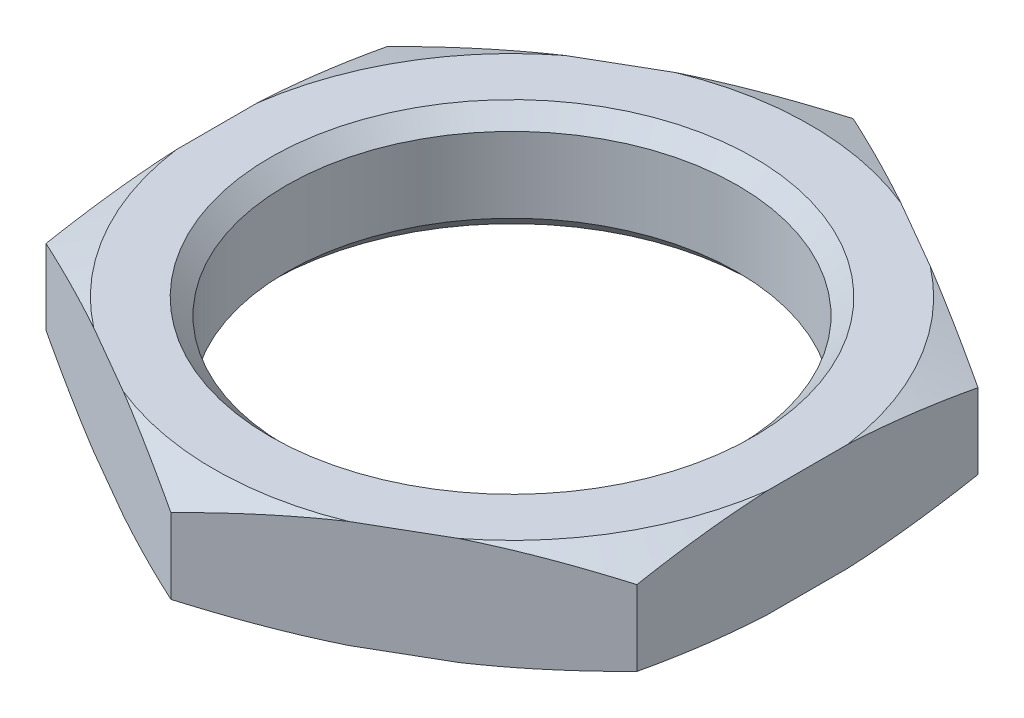
from build123d import *

# Parameters (mm, degrees)
SKETCH1_R           = 4.2
BOSS_EXTRUDE1_DEPTH = 2
CHAMFER1_SIZE       = 0.3


with BuildPart() as part:
    # Sketch1 → Boss-Extrude1 (new body)
    with BuildSketch(Plane(origin=(0, 0, 0), x_dir=(1, 0, 0), z_dir=(0, 1, 0))):
        Polygon((0, 6.350852961), (-5.5, 3.175426481), (-5.5, -3.175426481), (0, -6.350852961), (5.5, -3.175426481), (5.5, 3.175426481), align=None)
        with Locations(Location((0, 0, 0), (0, 0, 270))):
            Circle(SKETCH1_R, mode=Mode.SUBTRACT)
    extrude(amount=BOSS_EXTRUDE1_DEPTH)

    # Chamfer1
    chamfer1_edges = [part.edges().sort_by_distance(p)[0] for p in [
        (0, 0, -4.2),
        (0, 2, -4.2),
    ]]
    chamfer(chamfer1_edges, length=CHAMFER1_SIZE)

    # Sketch3 → Cut-Revolve1 (revolve, cut)
    with BuildSketch(Plane(origin=(0, 0, 0), x_dir=(0, 0, -1), z_dir=(1, 0, 0))):
        Polygon((-6.350852961, 0), (-5.550852961, 0), (-6.350852961, 0.3), align=None)
        Polygon((-6.350852961, 2), (-6.350852961, 1.7), (-5.550852961, 2), align=None)
    revolve(axis=Axis((0, 0, 0), (0, 1, 0)), mode=Mode.SUBTRACT)


solid = part.part
